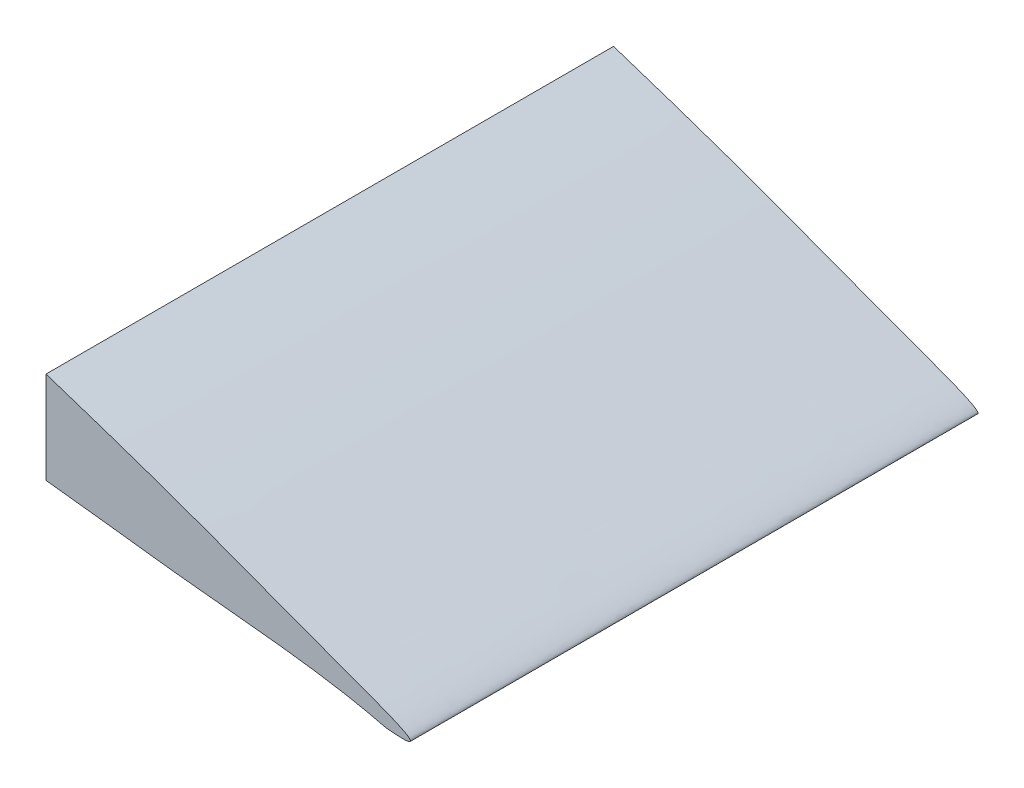
from build123d import *

# Parameters (mm, degrees)
BOSS_EXTRUDE1_DEPTH = 50.8
SKETCH2_R           = 6.35
SKETCH2_R_2         = 3.175
CUT_EXTRUDE1_DEPTH  = 320.788688435
SKETCH4_W           = 290.945593373
SKETCH4_H           = 117.489254048
CUT_EXTRUDE3_DEPTH  = 320.788688435


with BuildPart() as part:
    # Sketch1 → Boss-Extrude1 (new body)
    with BuildSketch(Plane.XY):
        with BuildLine():
            add(Edge.make_bspline(
                [(0.000560351, 0.000130087), (0.810633127, 7.359196055), (8.649092025, 17.856605174), (26.286719818, 29.975176328), (52.111128271, 42.069215275), (89.597618475, 49.290763054), (131.400792109, 47.884831915), (173.256699242, 40.041104278), (217.961060472, 29.612974894), (256.952064401, 19.528920948), (290.35983767, 8.71099439), (301.273197721, 4.382828139), (314.816918223, -0.516206742), (309.846313895, 0.000130087)],
                knots=[0, 0, 0, 0, 0.060863618, 0.113688265, 0.188608742, 0.312908923, 0.448482434, 0.557612135, 0.691544113, 0.852438279, 0.92975597, 0.976058229, 1, 1, 1, 1], degree=3))
            add(Edge.make_bspline(
                [(309.846313895, 0.000130087), (303.956832565, 1.47095521), (293.989507544, 2.093987313), (276.26402299, 4.514356704), (260.846344817, 5.427413394), (235.858814759, 7.870306192), (205.101424636, 8.838080282), (157.718638092, 9.030650149), (110.497331172, 6.181495223), (66.506197185, -0.586669107), (36.454672816, -6.098499901), (15.316603331, -6.189065841), (1.230714189, -6.924076091), (0.000560351, 0.000130087)],
                knots=[0, 0, 0, 0, 0.057787081, 0.095274891, 0.171021118, 0.205339302, 0.335319146, 0.464904334, 0.658702312, 0.785511947, 0.893517288, 0.94309214, 1, 1, 1, 1], degree=3))
        make_face()
    extrude(amount=BOSS_EXTRUDE1_DEPTH)

    # Sketch2 → Cut-Extrude1 (cut, through all)
    with BuildSketch(Plane.XY.offset(50.8)):
        with Locations((20.32, 10.16)):
            Circle(SKETCH2_R)
        with Locations((227.296313895, 19.050130087)):
            Circle(SKETCH2_R_2)
    extrude(amount=-CUT_EXTRUDE1_DEPTH, mode=Mode.SUBTRACT)

    # Sketch4 → Cut-Extrude3 (cut, through all)
    with BuildSketch(Plane.XY.offset(50.8)):
        with Locations((133.927203314, 34.528076629)):
            Rectangle(SKETCH4_W, SKETCH4_H)
    extrude(amount=-CUT_EXTRUDE3_DEPTH, mode=Mode.SUBTRACT)


solid = part.part
